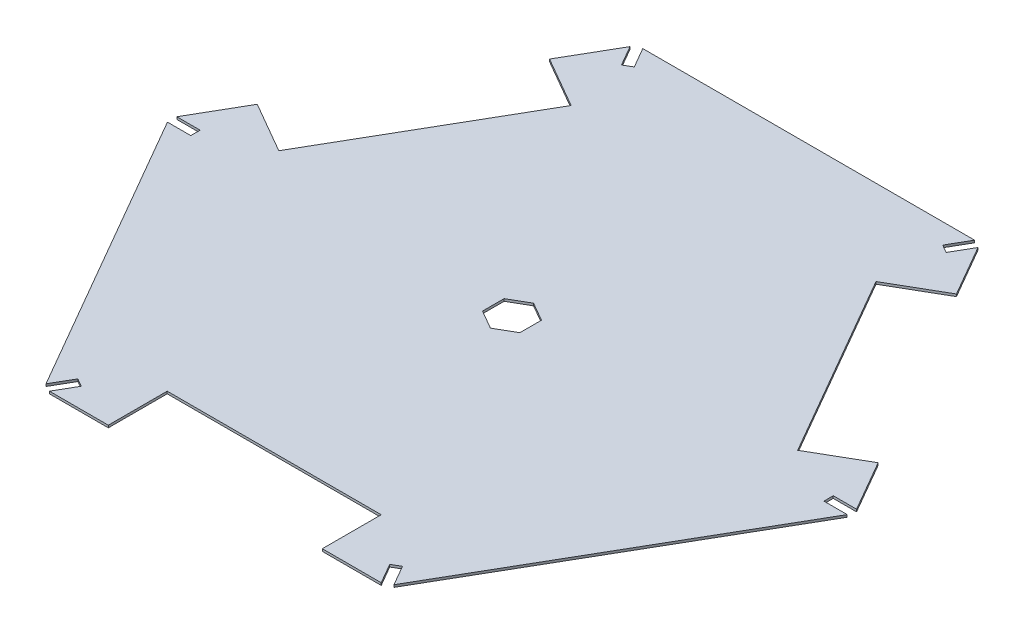
from build123d import *

# Parameters (mm, degrees)
BOSS_EXTRUDE1_DEPTH = 1.5875
SKETCH2_W           = 145.335303163
SKETCH2_H           = 40
CUT_EXTRUDE1_DEPTH  = 1.5875


with BuildPart() as part:
    # Sketch1 → Boss-Extrude1 (new body)
    with BuildSketch(Plane(origin=(0, 0, 0), x_dir=(1, 0, 0), z_dir=(0, 1, 0))):
        Polygon((-186.195305431, -192.980619007), (39.139997732, -192.980619007), (31.222715493, -179.267483912), (36.721976807, -176.092483912), (44.63925905, -189.805619015), (157.306910641, 5.34047791), (141.472346164, 5.34047791), (141.47234615, 11.690477885), (157.306910636, 11.690477885), (44.639259046, 206.83657481), (36.721976807, 193.123439715), (31.222715493, 196.298439715), (39.139997732, 210.01157481), (-186.195305431, 210.01157481), (-178.278023193, 196.298439715), (-183.777284507, 193.123439715), (-191.694566745, 206.83657481), (-304.362218326, 11.690477902), (-288.52765385, 11.690477902), (-288.52765385, 5.340477902), (-304.362218326, 5.340477902), (-191.694566745, -189.805619007), (-183.777284507, -176.092483912), (-178.278023193, -179.267483912), align=None)
        Polygon((-86.22765385, 15.84782632), (-86.22765385, 1.183129483), (-73.52765385, -6.149218936), (-60.82765385, 1.183129483), (-60.82765385, 15.84782632), (-73.52765385, 23.180174739), align=None, mode=Mode.SUBTRACT)
    extrude(amount=BOSS_EXTRUDE1_DEPTH)

    # Sketch2 → Cut-Extrude1 (cut)
    with BuildSketch(Plane(origin=(0, 1.5875, 0), x_dir=(1, 0, 0), z_dir=(0, 1, 0))):
        with Locations((-73.527653849, -172.980619007)):
            Rectangle(SKETCH2_W, SKETCH2_H)
        Polygon((137.306910632, 46.331494061), (64.63925905, 172.195558667), (29.998242899, 152.195558667), (102.66589448, 26.331494061), align=None)
        Polygon((-211.694566745, 172.195558659), (-284.362218326, 46.331494053), (-249.721202175, 26.331494053), (-177.053550594, 152.195558659), align=None)
    extrude(amount=-CUT_EXTRUDE1_DEPTH, mode=Mode.SUBTRACT)


solid = part.part
